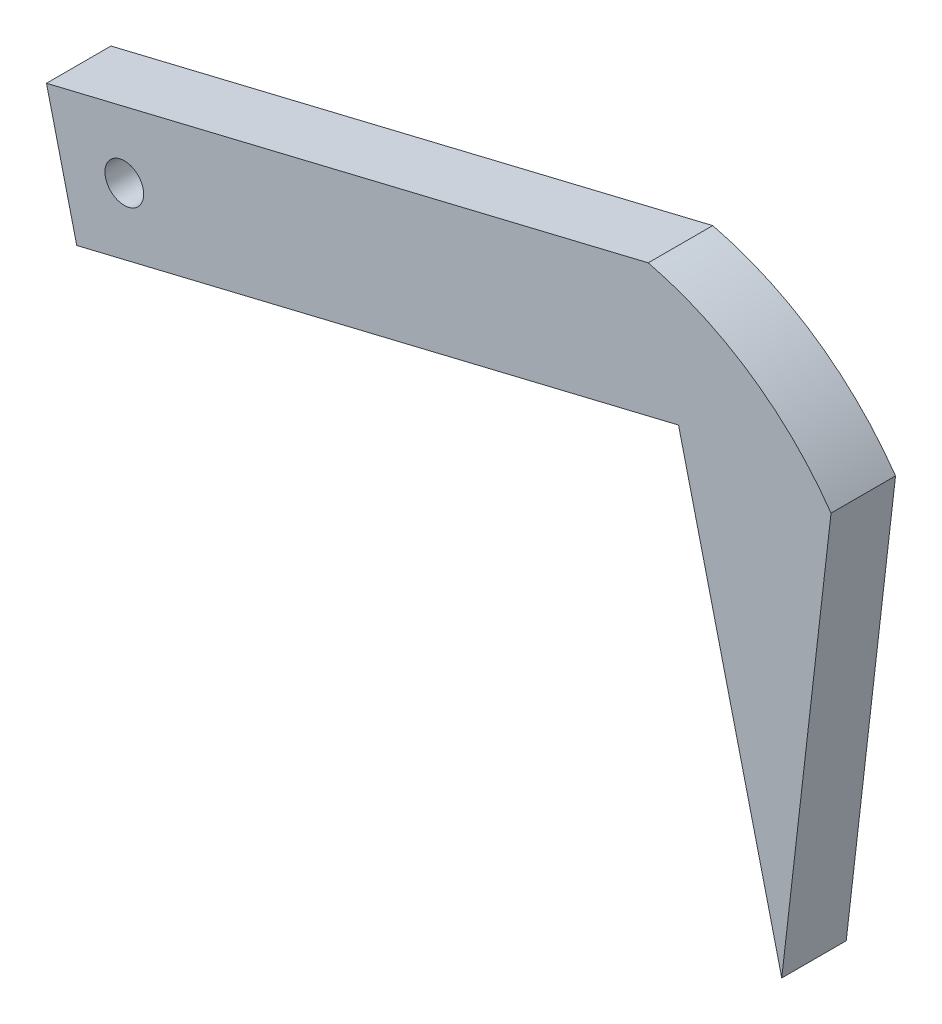
from build123d import *

# Parameters (mm, degrees)
ESQUISSE1_R        = 1.5
BOSS_EXTRU_1_DEPTH = 5


with BuildPart() as part:
    # Esquisse1 → Boss.-Extru.1 (new body)
    with BuildSketch(Plane.XY):
        with BuildLine():
            Line((60.83059411, 1.550480806), (57.008150143, -31.575585963))
            Line((57.008150143, -31.575585963), (49.00608135, 1.550480806))
            Line((49.00608135, 1.550480806), (2.348102713, -9.720412216))
            Line((2.348102713, -9.720412216), (0, 0))
            Line((0, 0), (46.657978637, 11.270893022))
            ThreePointArc((46.657978637, 11.270893022), (54.632637101, 7.705925529), (60.83059411, 1.550480806))
        make_face()
        with Locations((6.034257464, -3.686154752)):
            Circle(ESQUISSE1_R, mode=Mode.SUBTRACT)
    extrude(amount=BOSS_EXTRU_1_DEPTH)


solid = part.part
